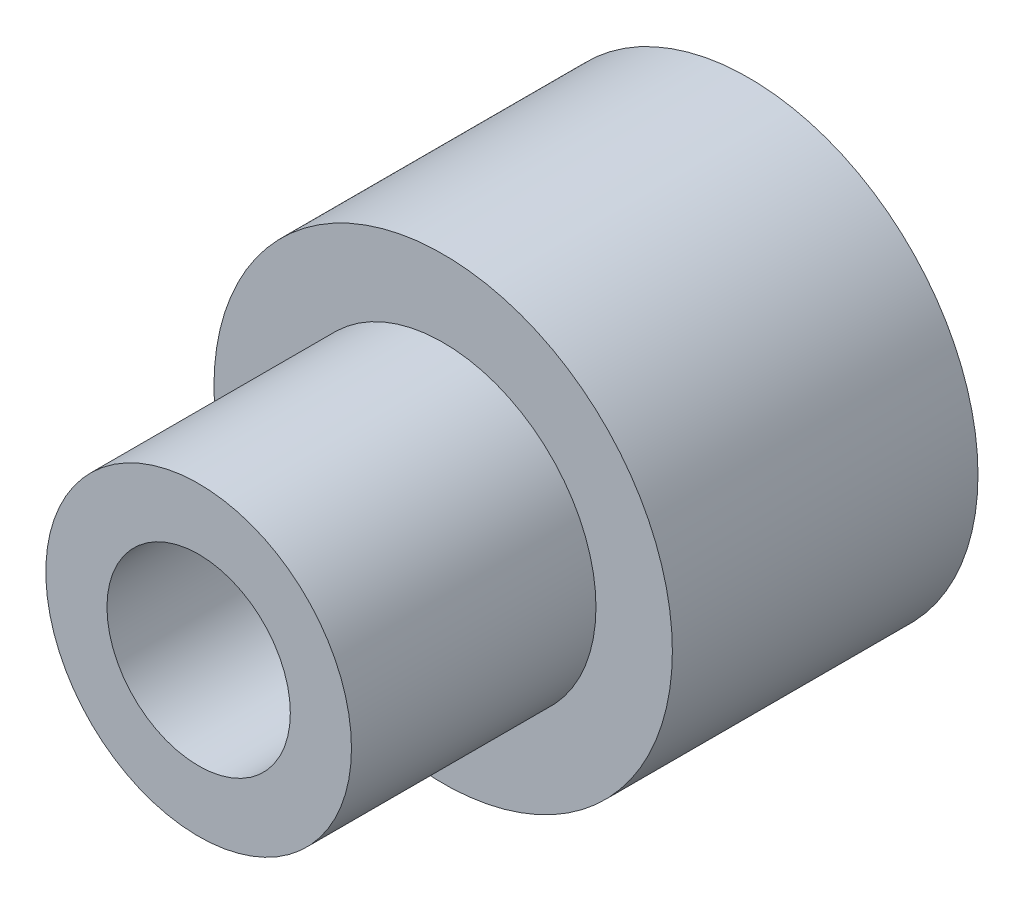
from build123d import *

# Parameters (mm, degrees)
SKETCH_1_R      = 7.5
EXTRUDE_1_DEPTH = 10
SKETCH_2_R      = 5
SKETCH_2_R_2    = 3
EXTRUDE_2_DEPTH = 8


with BuildPart() as part:
    # 草图1 → 凸台-拉伸1 (new body)
    with BuildSketch(Plane.XY):
        Circle(SKETCH_1_R)
    extrude(amount=EXTRUDE_1_DEPTH)

    # 草图2 → 凸台-拉伸2 (add)
    with BuildSketch(Plane.XY.offset(10)):
        Circle(SKETCH_2_R)
        Circle(SKETCH_2_R_2, mode=Mode.SUBTRACT)
    extrude(amount=EXTRUDE_2_DEPTH)


solid = part.part
